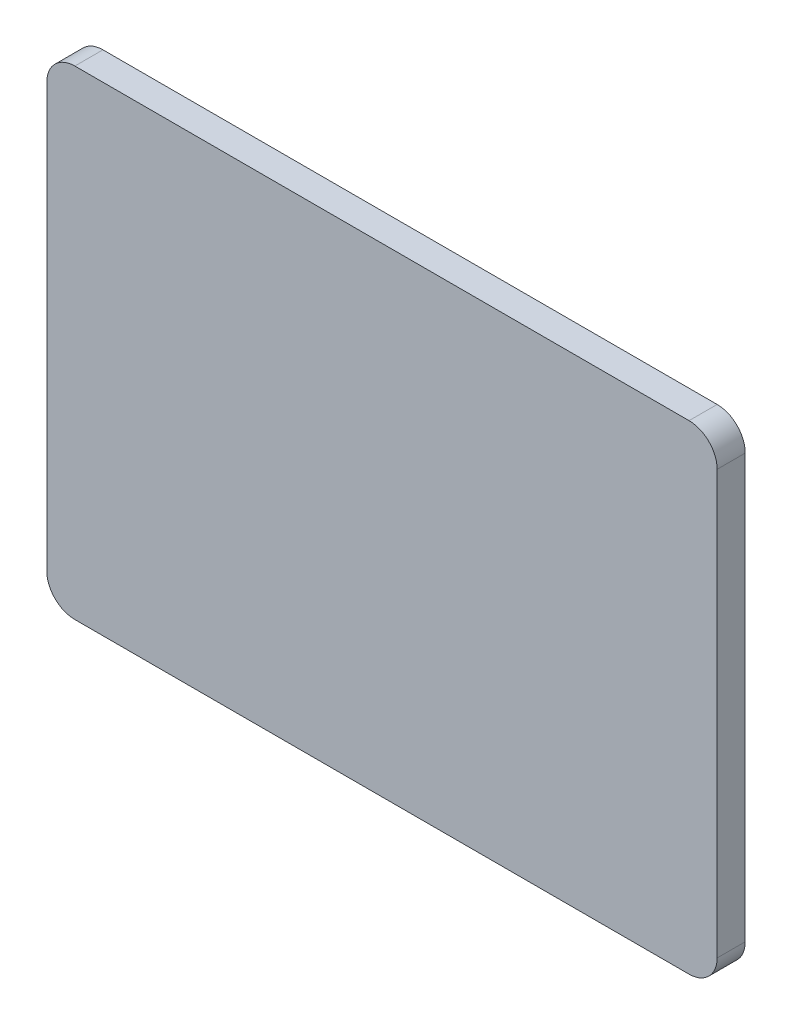
from build123d import *

# Parameters (mm, degrees)
ESQUISSE1_W        = 358
ESQUISSE1_H        = 256
BOSS_EXTRU_1_DEPTH = 15
CONG_1_R           = 15


with BuildPart() as part:
    # Esquisse1 → Boss.-Extru.1 (new body)
    with BuildSketch(Plane.XY):
        with Locations((179, 128)):
            Rectangle(ESQUISSE1_W, ESQUISSE1_H)
    extrude(amount=BOSS_EXTRU_1_DEPTH)

    # Congé1
    cong_1_edges = [part.edges().sort_by_distance(p)[0] for p in [
        (0, 256, 7.5),
        (358, 256, 7.5),
        (358, 0, 7.5),
        (0, 0, 7.5),
    ]]
    fillet(cong_1_edges, radius=CONG_1_R)


solid = part.part
